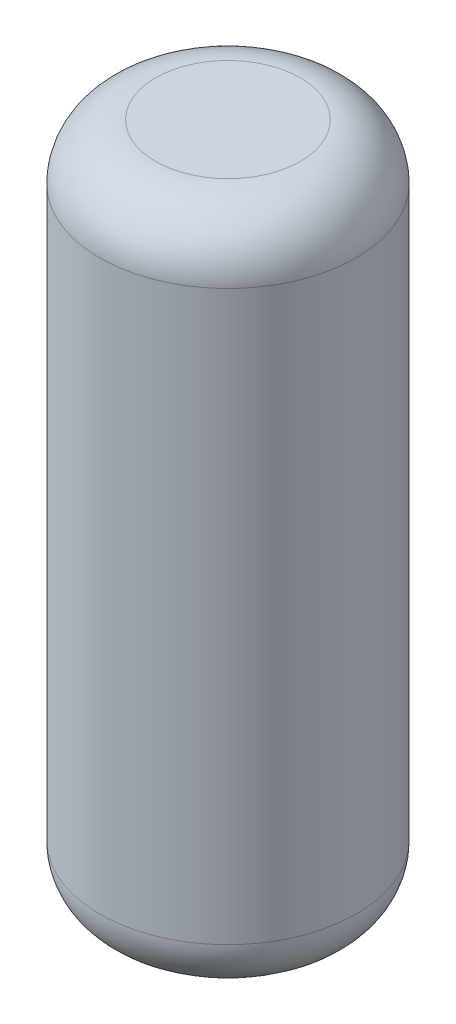
from build123d import *

# Parameters (mm, degrees)
SKETCH3_R           = 12.7
BOSS_EXTRUDE1_DEPTH = 19.05
SHELL1_T            = -2.54
BOSS_EXTRUDE2_START = -19.05
SKETCH6_R           = 12.7
BOSS_EXTRUDE2_DEPTH = 25.4
SKETCH7_R           = 7.9375
CUT_EXTRUDE3_DEPTH  = 25.4


with BuildPart() as part:
    # Sketch2 → Revolve1 (revolve)
    with BuildSketch(Plane.XY, mode=Mode.PRIVATE) as revolve1_sk:
        with BuildLine():
            Line((0, -232.41), (49.53, -232.41))
            ThreePointArc((49.53, -232.41), (76.470768363, -221.250768363), (87.63, -194.31))
            Line((87.63, -194.31), (87.63, -156.21))
            Line((87.63, -156.21), (87.63, 156.21))
            Line((87.63, 156.21), (87.63, 194.31))
            ThreePointArc((87.63, 194.31), (76.470768363, 221.250768363), (49.53, 232.41))
            Line((49.53, 232.41), (0, 232.41))
            Line((0, 232.41), (0, -232.41))
        make_face()
    revolve(revolve1_sk.sketch.rotate(Axis((0, -232.41, 0), (0, 1, 0)), 90), axis=Axis((0, -232.41, 0), (0, 1, 0)))

    # Sketch3 → Boss-Extrude1 (add)
    with BuildSketch(Plane(origin=(0, -232.41, 0), x_dir=(-1, 0, 0), z_dir=(0, -1, 0))):
        with Locations(Location((0, 0, 0), (0, 0, 270))):
            Circle(SKETCH3_R)
    extrude(amount=BOSS_EXTRUDE1_DEPTH)

    # Shell1
    shell1_openings = [part.faces().sort_by_distance(p)[0] for p in [
        (0, -251.46, 0),
    ]]
    offset(amount=SHELL1_T, openings=shell1_openings, kind=Kind.INTERSECTION)

    # Sketch6 → Boss-Extrude2 (add)
    with BuildSketch(Plane(origin=(0, -251.46, 0), x_dir=(-1, 0, 0), z_dir=(0, -1, 0)).offset(BOSS_EXTRUDE2_START)):
        with Locations(Location((0, 0, 0), (0, 0, 270))):
            Circle(SKETCH6_R)
    extrude(amount=BOSS_EXTRUDE2_DEPTH)

    # Sketch7 → Cut-Extrude3 (cut)
    with BuildSketch(Plane.XZ.offset(257.81)):
        with Locations(Location((0, 0, 0), (0, 0, 270))):
            Circle(SKETCH7_R)
    extrude(amount=-CUT_EXTRUDE3_DEPTH, mode=Mode.SUBTRACT)


solid = part.part
